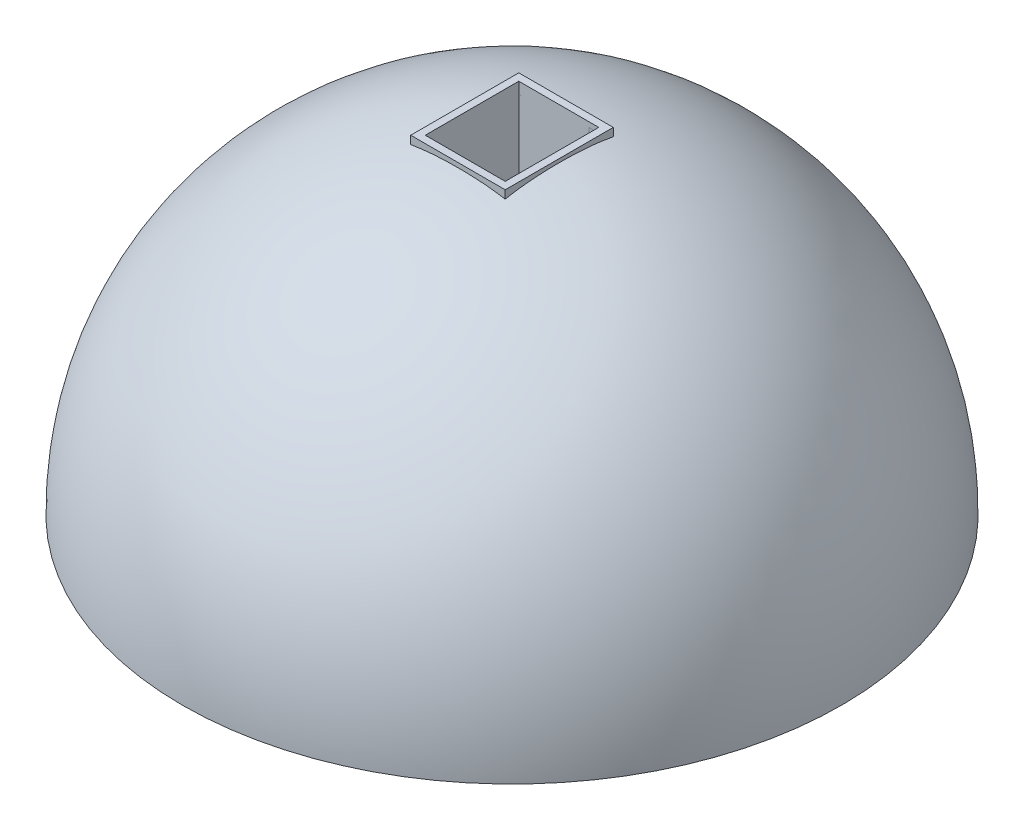
from build123d import *

# Parameters (mm, degrees)
SKETCH1_W           = 19.5
SKETCH1_H           = 22.3
SKETCH1_W_2         = 16.5
SKETCH1_H_2         = 19.3
BOSS_EXTRUDE1_DEPTH = 76.2
SKETCH3_W           = 16.5
SKETCH3_H           = 19.3
CUT_EXTRUDE1_DEPTH  = 25.4
SKETCH4_R           = 1.75
CUT_EXTRUDE2_DEPTH  = 12.7
SKETCH5_R           = 1.75
CUT_EXTRUDE3_DEPTH  = 12.7


with BuildPart() as part:
    # Sketch1 → Boss-Extrude1 (new body)
    with BuildSketch(Plane(origin=(0, 0, 0), x_dir=(1, 0, 0), z_dir=(0, 1, 0))):
        Rectangle(SKETCH1_W, SKETCH1_H)
        Rectangle(SKETCH1_W_2, SKETCH1_H_2, mode=Mode.SUBTRACT)
    extrude(amount=BOSS_EXTRUDE1_DEPTH)

    # Sketch4 → Cut-Extrude2 (cut)
    with BuildSketch(Plane(origin=(9.75, 0, 0), x_dir=(0, 0, -1), z_dir=(1, 0, 0))):
        with Locations((0, 24.537862789)):
            Circle(SKETCH4_R)
        with Locations((0, 52.099354453)):
            Circle(SKETCH4_R)
    extrude(amount=-CUT_EXTRUDE2_DEPTH, mode=Mode.SUBTRACT)

    # Sketch5 → Cut-Extrude3 (cut)
    with BuildSketch(Plane(origin=(0, 0, -11.15), x_dir=(-1, 0, 0), z_dir=(0, 0, -1))):
        with Locations((0, 15.725827397)):
            Circle(SKETCH5_R)
        with Locations((0, 39.197129193)):
            Circle(SKETCH5_R)
    extrude(amount=-CUT_EXTRUDE3_DEPTH, mode=Mode.SUBTRACT)


with BuildPart() as body_2:
    # Sketch2 → Revolve1 (revolve)
    with BuildSketch(Plane.ZY):
        with BuildLine():
            Line((-65.519554277, 7.62), (-68.019641629, 7.62))
            ThreePointArc((-68.019641629, 7.62), (-48.295672806, 56.07912413), (0, 76.2))
            Line((0, 76.2), (0, 73.7))
            ThreePointArc((0, 73.7), (-46.527890541, 54.311341606), (-65.519554277, 7.62))
        make_face()
    revolve(axis=Axis((0, 7.62, 0), (0, -1, 0)))

    # Sketch3 → Cut-Extrude1 (cut)
    with BuildSketch(Plane(origin=(0, 76.2, 0), x_dir=(1, 0, 0), z_dir=(0, 1, 0))):
        Rectangle(SKETCH3_W, SKETCH3_H)
    extrude(amount=-CUT_EXTRUDE1_DEPTH, mode=Mode.SUBTRACT)


solid = Compound([part.part, body_2.part])
